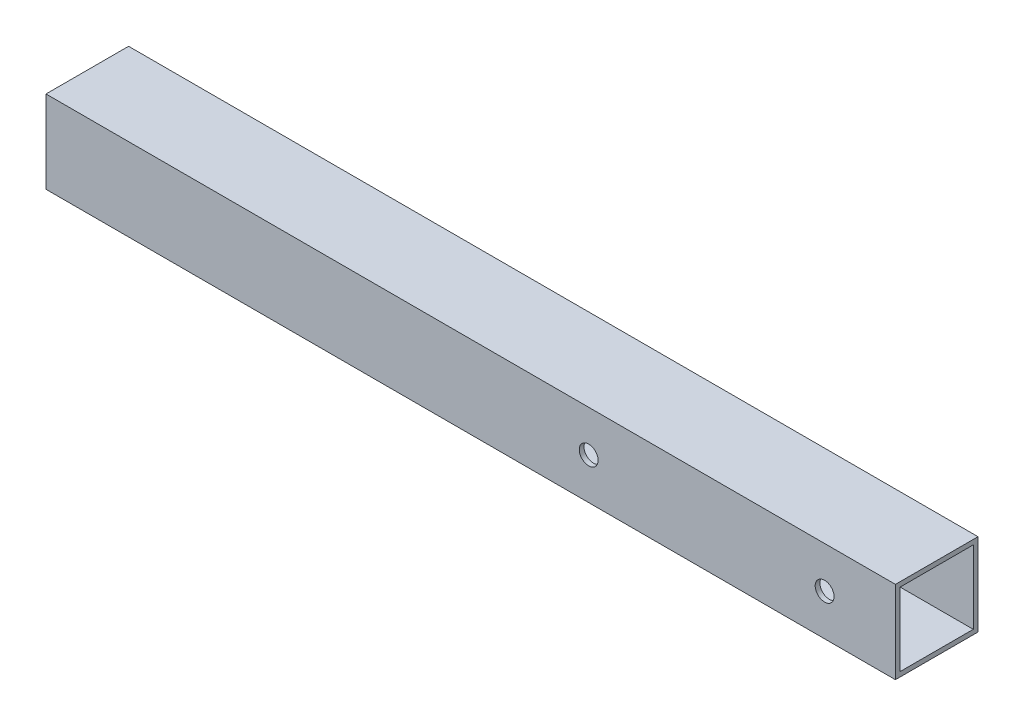
from build123d import *

# Parameters (mm, degrees)
SKETCH1_W           = 35
SKETCH1_H           = 35
SKETCH1_W_2         = 31
SKETCH1_H_2         = 31
BOSS_EXTRUDE1_DEPTH = 360
SKETCH2_R           = 4
CUT_EXTRUDE1_DEPTH  = 364.386846212


with BuildPart() as part:
    # Sketch1 → Boss-Extrude1 (new body)
    with BuildSketch(Plane(origin=(0, 0, 0), x_dir=(0, 0, -1), z_dir=(1, 0, 0))):
        with Locations((17.5, 17.5)):
            Rectangle(SKETCH1_W, SKETCH1_H)
        with Locations((17.5, 17.5)):
            Rectangle(SKETCH1_W_2, SKETCH1_H_2, mode=Mode.SUBTRACT)
    extrude(amount=BOSS_EXTRUDE1_DEPTH)

    # Sketch2 → Cut-Extrude1 (cut, through all)
    with BuildSketch(Plane.XY):
        with Locations((330, 17.5)):
            Circle(SKETCH2_R)
        with Locations((230, 17.5)):
            Circle(SKETCH2_R)
    extrude(amount=-CUT_EXTRUDE1_DEPTH, mode=Mode.SUBTRACT)


solid = part.part
